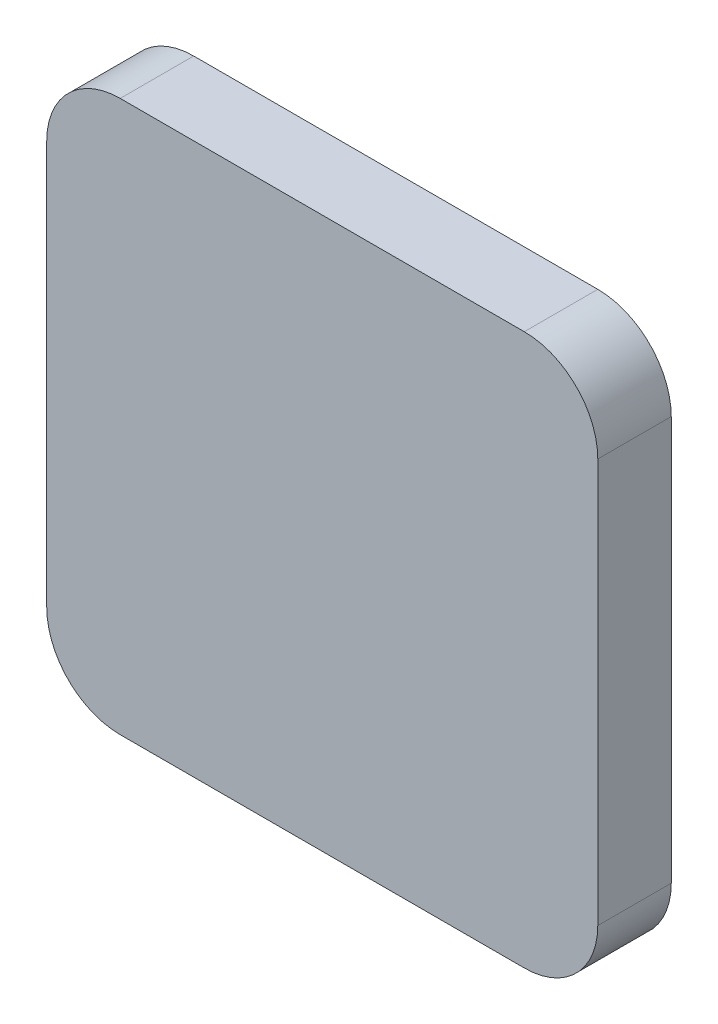
from build123d import *

# Parameters (mm, degrees)
EXTRUDE_1_DEPTH = 2


with BuildPart() as part:
    # 草图1 → 凸台-拉伸1 (new body)
    with BuildSketch(Plane.XY):
        with BuildLine():
            Line((-30.701683105, -8.722897281), (-19.701683105, -8.722897281))
            ThreePointArc((-19.701683105, -8.722897281), (-18.287469543, -9.308683719), (-17.701683105, -10.722897281))
            Line((-17.701683105, -10.722897281), (-17.701683105, -21.722897281))
            ThreePointArc((-17.701683105, -21.722897281), (-18.287469543, -23.137110844), (-19.701683105, -23.722897281))
            Line((-19.701683105, -23.722897281), (-30.701683105, -23.722897281))
            ThreePointArc((-30.701683105, -23.722897281), (-32.115896667, -23.137110844), (-32.701683105, -21.722897281))
            Line((-32.701683105, -21.722897281), (-32.701683105, -10.722897281))
            ThreePointArc((-32.701683105, -10.722897281), (-32.115896667, -9.308683719), (-30.701683105, -8.722897281))
        make_face()
    extrude(amount=EXTRUDE_1_DEPTH)


solid = part.part
